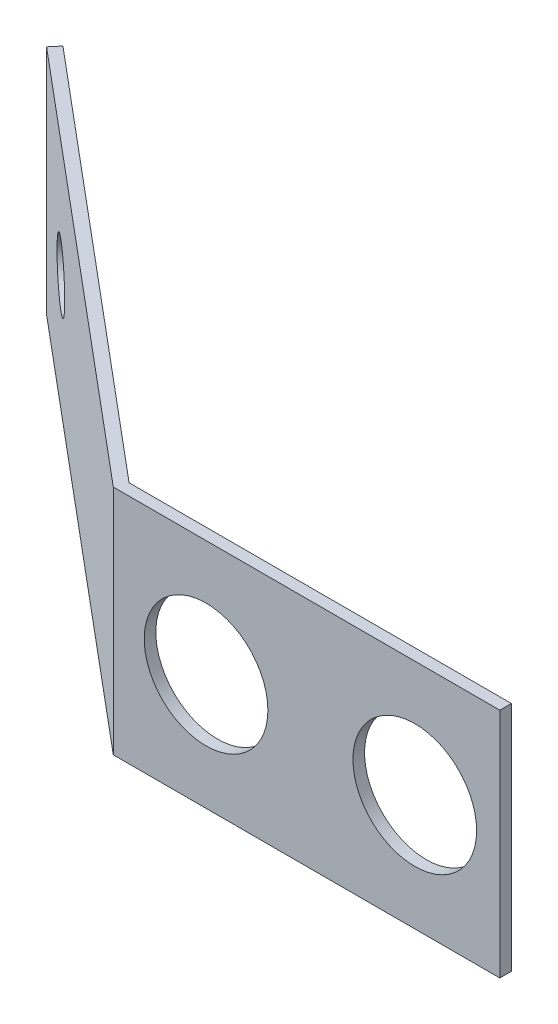
from build123d import *

# Parameters (mm, degrees)
EXTRUDE_THIN1_DEPTH = 30
SKETCH2_R           = 4
CUT_EXTRUDE1_DEPTH  = 10
SKETCH3_R           = 8
CUT_EXTRUDE2_DEPTH  = 10


with BuildPart() as part:
    # Sketch1 → Extrude-Thin1 (new body)
    with BuildSketch(Plane(origin=(0, 0, 0), x_dir=(1, 0, 0), z_dir=(0, 1, 0))):
        Polygon((-53.623111018, 44.995132678), (0, 0), (50, 0), (50, 1.5), (0.545955351, 1.5), (-52.658929604, 46.144199343), align=None)
    extrude(amount=EXTRUDE_THIN1_DEPTH)

    # Sketch2 → Cut-Extrude1 (cut)
    with BuildSketch(Plane(origin=(0, 0, 0), x_dir=(0.7660444431189818, 0, 0.6427876096865349), z_dir=(-0.6427876096865348, 0, 0.7660444431189817))):
        with Locations((-55, 15)):
            Circle(SKETCH2_R)
    extrude(amount=-CUT_EXTRUDE1_DEPTH, mode=Mode.SUBTRACT)

    # Sketch3 → Cut-Extrude2 (cut)
    with BuildSketch(Plane.XY):
        with Locations((12, 15)):
            Circle(SKETCH3_R)
        with Locations((39, 15)):
            Circle(SKETCH3_R)
    extrude(amount=-CUT_EXTRUDE2_DEPTH, mode=Mode.SUBTRACT)


solid = part.part
